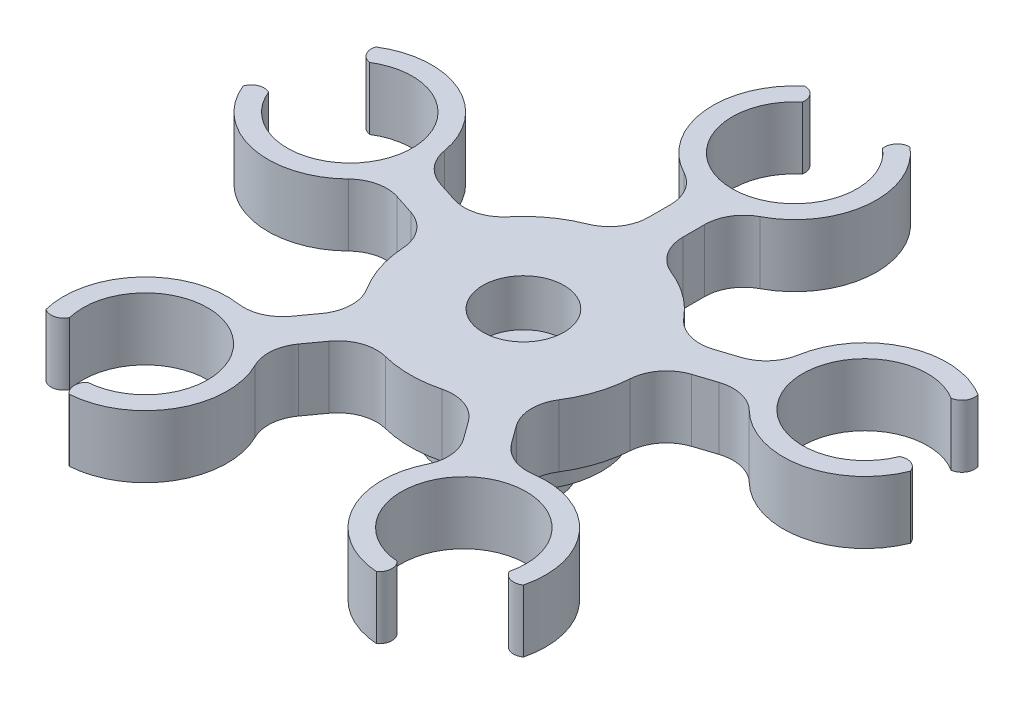
from build123d import *

# Parameters (mm, degrees)
BOSS_EXTRU_1_DEPTH                 = 8
ESQUISSE5_R                        = 14.567729557
BOSS_EXTRU_2_DEPTH                 = 8
CONG_1_R                           = 5
CONG_2_R                           = 5
R_P_TITION_CIRCULAIRE8_COUNT       = 5
CONG_1_OF_R_P_TITION_CIRCULAIRE8_R = 5
CONG_2_OF_R_P_TITION_CIRCULAIRE8_R = 5
ESQUISSE9_R                        = 10
BOSS_EXTRU_4_DEPTH                 = 5
ESQUISSE10_R                       = 5
BOSS_EXTRU_5_DEPTH                 = 5
ESQUISSE12_R                       = 5.2
ENL_V_MAT_EXTRU_3_DEPTH            = 6


with BuildPart() as part:
    # Esquisse4 → Boss.-Extru.1 (new body)
    with BuildSketch(Plane(origin=(0, 0, 0), x_dir=(1, 0, 0), z_dir=(0, 1, 0))):
        with BuildLine():
            Line((2.2, -20.318922986), (2.2, -10.266937226))
            ThreePointArc((2.2, -10.266937226), (10.190195312, -2.531781884), (6.749269902, 8.043466653))
            ThreePointArc((6.749269902, 8.043466653), (5.499269902, 7.46058208), (5.142300877, 6.128355545))
            ThreePointArc((5.142300877, 6.128355545), (0, -8), (-5.142300877, 6.128355545))
            ThreePointArc((-5.142300877, 6.128355545), (-5.499269902, 7.46058208), (-6.749269902, 8.043466653))
            ThreePointArc((-6.749269902, 8.043466653), (-10.190195312, -2.531781884), (-2.2, -10.266937226))
            Line((-2.2, -10.266937226), (-2.2, -20.318922986))
            ThreePointArc((-2.2, -20.318922986), (0, -20.179612502), (2.2, -20.318922986))
        make_face()
    boss_extru_1 = extrude(amount=BOSS_EXTRU_1_DEPTH)

    # Esquisse5 → Boss.-Extru.2 (add)
    with BuildSketch(Plane(origin=(0, 0, 0), x_dir=(1, 0, 0), z_dir=(0, 1, 0))):
        with Locations((0, -34.71957382)):
            Circle(ESQUISSE5_R)
    extrude(amount=BOSS_EXTRU_2_DEPTH)

    # Congé1
    cong_1_edges = [part.edges().sort_by_distance(p)[0] for p in [
        (2.2, 4, 10.266937226),
        (-2.2, 4, 10.266937226),
    ]]
    fillet(cong_1_edges, radius=CONG_1_R)

    # Congé2
    cong_2_edges = [part.edges().sort_by_distance(p)[0] for p in [
        (2.2, 4, 20.318922986),
        (-2.2, 4, 20.318922986),
    ]]
    fillet(cong_2_edges, radius=CONG_2_R)

    # Répétition circulaire8: Boss.-Extru.1 ×5 about axis
    r_p_tition_circulaire8_axis = Axis((0, 0, 34.71957382), (0, 1, 0))
    for i in range(1, R_P_TITION_CIRCULAIRE8_COUNT):
        add(boss_extru_1.rotate(r_p_tition_circulaire8_axis, i * 360 / R_P_TITION_CIRCULAIRE8_COUNT))

    # Congé1 of Répétition circulaire8
    cong_1_of_r_p_tition_circulaire8_edges = [part.edges().sort_by_distance(p)[0] for p in [
        (-22.576001986, 4, 25.070969219),
        (-23.935676761, 4, 29.255617891),
        (-16.152736557, 4, 53.209044827),
        (-12.593061782, 4, 55.795299938),
        (12.593061782, 4, 55.795299938),
        (16.152736557, 4, 53.209044827),
        (23.935676761, 4, 29.255617891),
        (22.576001986, 4, 25.070969219),
    ]]
    fillet(cong_1_of_r_p_tition_circulaire8_edges, radius=CONG_1_OF_R_P_TITION_CIRCULAIRE8_R)

    # Congé2 of Répétition circulaire8
    cong_2_of_r_p_tition_circulaire8_edges = [part.edges().sort_by_distance(p)[0] for p in [
        (-13.015995427, 4, 28.177203647),
        (-14.375670202, 4, 32.361852318),
        (-10.244327571, 4, 45.07681752),
        (-6.684652796, 4, 47.66307263),
        (6.684652796, 4, 47.66307263),
        (10.244327571, 4, 45.07681752),
        (14.375670202, 4, 32.361852318),
        (13.015995427, 4, 28.177203647),
    ]]
    fillet(cong_2_of_r_p_tition_circulaire8_edges, radius=CONG_2_OF_R_P_TITION_CIRCULAIRE8_R)

    # Esquisse9 → Boss.-Extru.4 (add)
    with BuildSketch(Plane.XZ):
        with Locations(Location((-0.001570364, 34.773487041, 0), (0, 0, 90))):
            Circle(ESQUISSE9_R)
    extrude(amount=BOSS_EXTRU_4_DEPTH)

    # Esquisse10 → Boss.-Extru.5 (add)
    with BuildSketch(Plane.XZ.offset(5)):
        with Locations(Location((0, 35.07133439, 0), (0, 0, 270))):
            Circle(ESQUISSE10_R)
    extrude(amount=BOSS_EXTRU_5_DEPTH)

    # Esquisse12 → Enlèv. mat.-Extru.3 (cut)
    with BuildSketch(Plane(origin=(0, 8, 0), x_dir=(1, 0, 0), z_dir=(0, 1, 0))):
        with Locations(Location((-0.060638465, -34.698547828, 0), (0, 0, 270))):
            Circle(ESQUISSE12_R)
    extrude(amount=-ENL_V_MAT_EXTRU_3_DEPTH, mode=Mode.SUBTRACT)


solid = part.part
